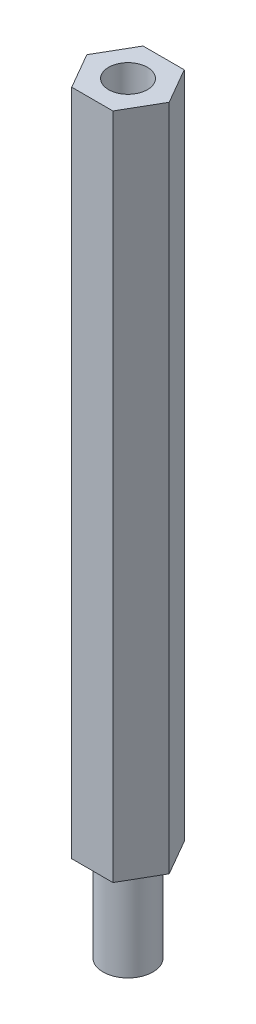
from build123d import *

# Parameters (mm, degrees)
EXTRUDE_1_DEPTH     = 43
SKETCH_6_R          = 1.6
EXTRUDE_2_DEPTH     = 6
SKETCH_7_R          = 1.25
CUT_EXTRUDE_1_DEPTH = 5


with BuildPart() as part:
    # 草图4 → 凸台-拉伸1 (new body)
    with BuildSketch(Plane(origin=(0, 0, 0), x_dir=(1, 0, 0), z_dir=(0, 1, 0))):
        Polygon((1.325, -2.29496732), (2.65, 0), (1.325, 2.29496732), (-1.325, 2.29496732), (-2.65, 0), (-1.325, -2.29496732), align=None)
    extrude(amount=EXTRUDE_1_DEPTH)

    # 草图6 → 凸台-拉伸2 (add)
    with BuildSketch(Plane(origin=(0, 0, 0), x_dir=(-1, 0, 0), z_dir=(0, -1, 0))):
        with Locations(Location((0, 0, 0), (0, 0, 270))):
            Circle(SKETCH_6_R)
    extrude(amount=EXTRUDE_2_DEPTH)

    # 草图7 → 切除-拉伸1 (cut)
    with BuildSketch(Plane(origin=(0, 43, 0), x_dir=(1, 0, 0), z_dir=(0, 1, 0))):
        with Locations(Location((0, 0, 0), (0, 0, 270))):
            Circle(SKETCH_7_R)
    extrude(amount=-CUT_EXTRUDE_1_DEPTH, mode=Mode.SUBTRACT)


solid = part.part
